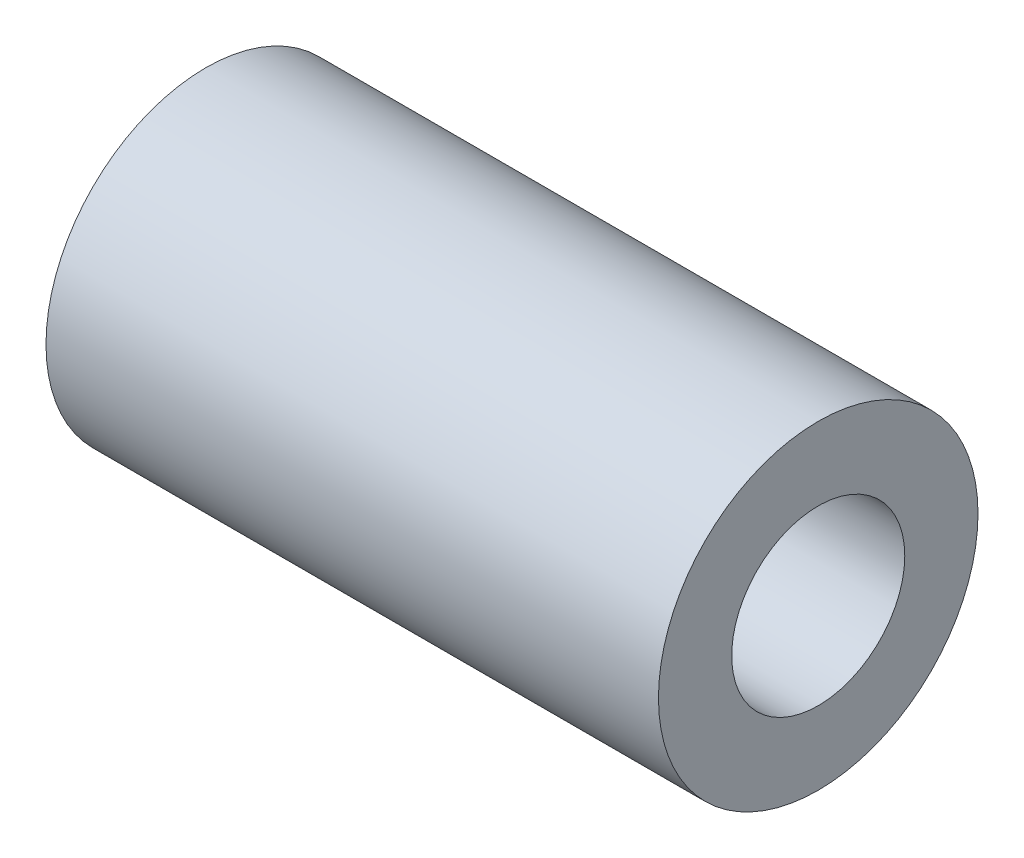
from build123d import *

# Parameters (mm, degrees)
SKETCH_1_W = 23
SKETCH_1_H = 2.75


with BuildPart() as part:
    # Эскиз1 → Повернуть1 (revolve)
    with BuildSketch(Plane.XY, mode=Mode.PRIVATE) as revolve_1_sk:
        with Locations((0, 4.625)):
            Rectangle(SKETCH_1_W, SKETCH_1_H)
    revolve(revolve_1_sk.sketch.rotate(Axis((0, 0, 0), (-1, 0, 0)), 90), axis=Axis((0, 0, 0), (-1, 0, 0)))


solid = part.part
